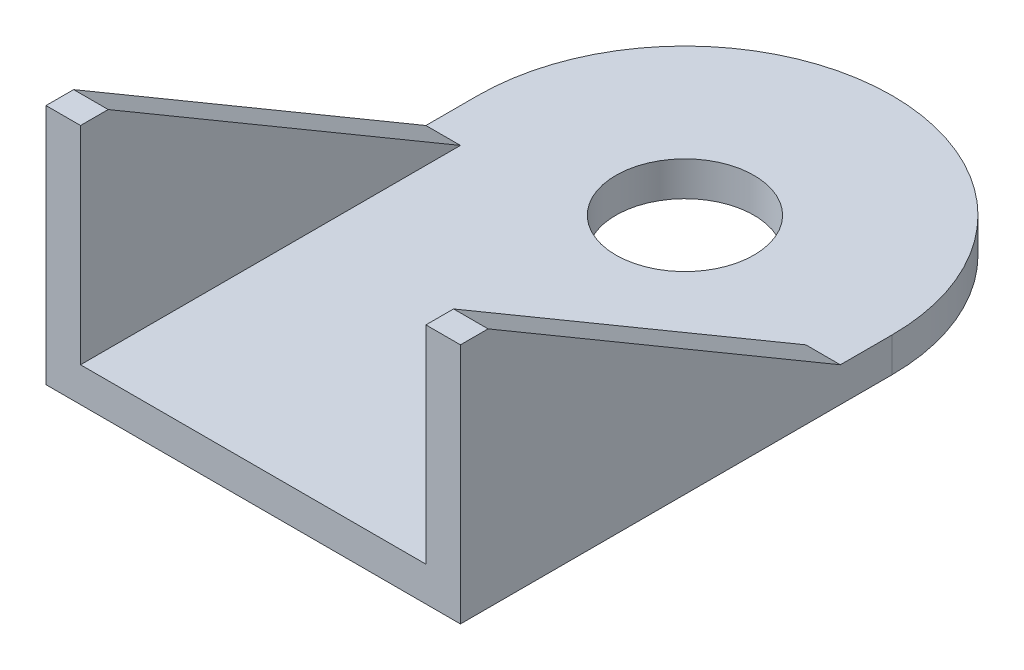
from build123d import *

# Parameters (mm, degrees)
SKETCH_1_R      = 12
SKETCH_1_R_2    = 4
EXTRUDE_1_DEPTH = 2
EXTRUDE_2_DEPTH = 2


with BuildPart() as part:
    # 草图1 → 凸台-拉伸1 (new body)
    # profile 1 of 2: a face of its own
    with BuildSketch(Plane(origin=(0, 0, 0), x_dir=(1, 0, 0), z_dir=(0, 1, 0))):
        Circle(SKETCH_1_R)
        with Locations(Location((0, 0, 0), (0, 0, 270))):
            Circle(SKETCH_1_R_2, mode=Mode.SUBTRACT)
    # profile 2 of 2: a face of its own
    with BuildSketch(Plane(origin=(0, 0, 0), x_dir=(1, 0, 0), z_dir=(0, 1, 0))):
        with BuildLine():
            ThreePointArc((12, 0), (0, -12), (-12, 0))
            Line((-12, 0), (-12, -25))
            Line((-12, -25), (12, -25))
            Line((12, -25), (12, 0))
        make_face()
    extrude(amount=EXTRUDE_1_DEPTH)

    # 草图3 → 凸台-拉伸2 (add)
    with BuildSketch(Plane(origin=(12, 0, 0), x_dir=(0, 0, -1), z_dir=(1, 0, 0))):
        Polygon((-25, 2), (-25, 14), (-23.4, 14), (-3, 2), align=None)
    extrude_2 = extrude(amount=-EXTRUDE_2_DEPTH)

    # 镜向1: 凸台-拉伸2 across plane
    add(extrude_2.mirror(Plane(origin=(0, 0, 0), x_dir=(0, 0, 1), z_dir=(1, 0, 0))))


solid = part.part
